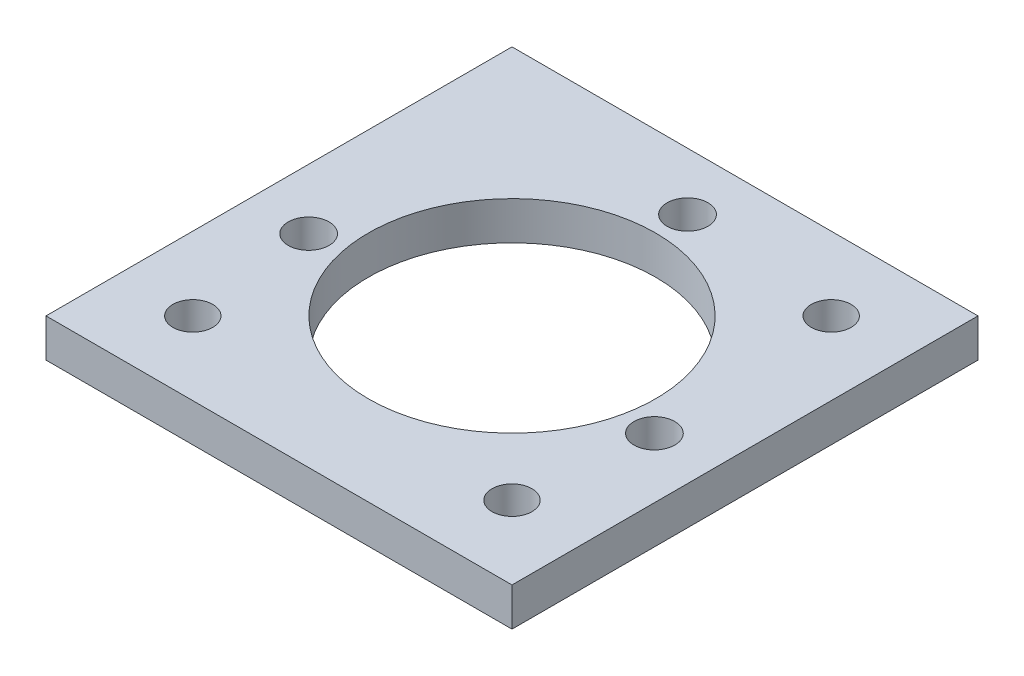
from build123d import *

# Parameters (mm, degrees)
SKETCH1_W                        = 73
SKETCH1_H                        = 73
SKETCH1_R                        = 3.2
SKETCH1_R_2                      = 22.5
BOSS_EXTRUDE1_DEPTH              = 6
TAP_DRILL_FOR_M6_HELICOIL1_D     = 6.25
TAP_DRILL_FOR_M6_HELICOIL1_DEPTH = 11.94
TAP_DRILL_FOR_M6_HELICOIL1_TIP   = 1.877689434


with BuildPart() as part:
    # Sketch1 → Boss-Extrude1 (new body)
    with BuildSketch(Plane(origin=(0, 0, 0), x_dir=(1, 0, 0), z_dir=(0, 1, 0))):
        with Locations((36.5, 36.5)):
            Rectangle(SKETCH1_W, SKETCH1_H)
        with Locations(Location((36.5, 64, 0), (0, 0, 270))):
            Circle(SKETCH1_R, mode=Mode.SUBTRACT)
        with Locations(Location((63.582213208, 31.724675114, 0), (0, 0, 270))):
            Circle(SKETCH1_R, mode=Mode.SUBTRACT)
        with Locations(Location((9.417786792, 31.724675114, 0), (0, 0, 270))):
            Circle(SKETCH1_R, mode=Mode.SUBTRACT)
        with Locations(Location((36.5, 36.5, 0), (0, 0, 270))):
            Circle(SKETCH1_R_2, mode=Mode.SUBTRACT)
    extrude(amount=BOSS_EXTRUDE1_DEPTH)

    # Tap Drill for M6 Helicoil1
    with Locations(Plane(origin=(0, 0, 0), x_dir=(-1, 0, 0), z_dir=(0, -1, 0))):
        with Locations((-11.5, 11.5), (-61.5, 11.5), (-61.5, 61.5)):
            Hole(TAP_DRILL_FOR_M6_HELICOIL1_D / 2, depth=TAP_DRILL_FOR_M6_HELICOIL1_DEPTH)
            with Locations((0, 0, -(TAP_DRILL_FOR_M6_HELICOIL1_DEPTH + TAP_DRILL_FOR_M6_HELICOIL1_TIP / 2))):  # 118° drill point
                Cone(0, TAP_DRILL_FOR_M6_HELICOIL1_D / 2, TAP_DRILL_FOR_M6_HELICOIL1_TIP, mode=Mode.SUBTRACT)


solid = part.part
